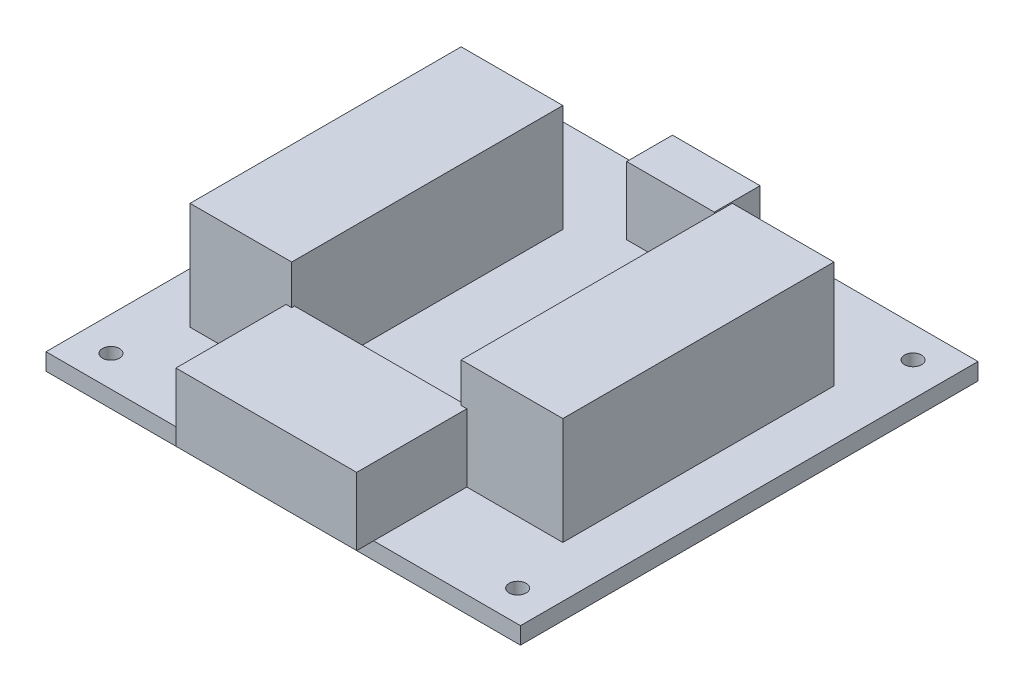
from build123d import *

# Parameters (mm, degrees)
SKETCH1_W           = 84
SKETCH1_H           = 81
BOSS_EXTRUDE1_DEPTH = 3
SKETCH2_W           = 18
SKETCH2_H           = 48
BOSS_EXTRUDE2_DEPTH = 19
SKETCH3_W           = 32
SKETCH3_H           = 20
SKETCH3_W_2         = 15.507070526
SKETCH3_H_2         = 8.100708483
BOSS_EXTRUDE3_DEPTH = 12
SKETCH4_R           = 1.5
CUT_EXTRUDE1_DEPTH  = 12


with BuildPart() as part:
    # Sketch1 → Boss-Extrude1 (new body)
    with BuildSketch(Plane(origin=(0, 0, 0), x_dir=(1, 0, 0), z_dir=(0, 1, 0))):
        Rectangle(SKETCH1_W, SKETCH1_H)
    extrude(amount=BOSS_EXTRUDE1_DEPTH)

    # Sketch2 → Boss-Extrude2 (add)
    with BuildSketch(Plane(origin=(0, 3, 0), x_dir=(1, 0, 0), z_dir=(0, 1, 0))):
        with Locations((-24, 0)):
            Rectangle(SKETCH2_W, SKETCH2_H)
        with Locations((24, 0)):
            Rectangle(SKETCH2_W, SKETCH2_H)
    extrude(amount=BOSS_EXTRUDE2_DEPTH)

    # Sketch3 → Boss-Extrude3 (add)
    with BuildSketch(Plane(origin=(0, 3, 0), x_dir=(1, 0, 0), z_dir=(0, 1, 0))):
        with Locations((0, -33.5)):
            Rectangle(SKETCH3_W, SKETCH3_H)
        with Locations((0, 32.113522915)):
            Rectangle(SKETCH3_W_2, SKETCH3_H_2)
    extrude(amount=BOSS_EXTRUDE3_DEPTH)

    # Sketch4 → Cut-Extrude1 (cut)
    with BuildSketch(Plane(origin=(0, 3, 0), x_dir=(1, 0, 0), z_dir=(0, 1, 0))):
        with Locations(Location((-36, 35, 0), (0, 0, 270))):
            Circle(SKETCH4_R)
        with Locations(Location((36, 35, 0), (0, 0, 270))):
            Circle(SKETCH4_R)
        with Locations(Location((36, -35, 0), (0, 0, 270))):
            Circle(SKETCH4_R)
        with Locations(Location((-36, -35, 0), (0, 0, 270))):
            Circle(SKETCH4_R)
    extrude(amount=-CUT_EXTRUDE1_DEPTH, mode=Mode.SUBTRACT)


solid = part.part
